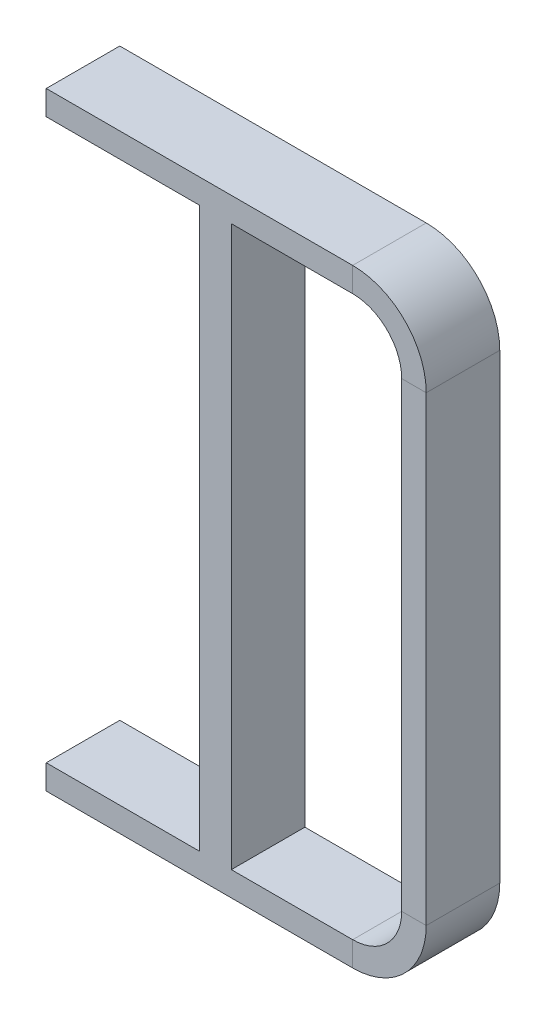
from build123d import *

# Parameters (mm, degrees)
SKETCH2_W           = 152.4
SKETCH2_H           = 50.8
SKETCH3_W           = 66.098972621
SKETCH3_H           = 152.4
BOSS_EXTRUDE1_DEPTH = 1229.106


with BuildPart() as part:
    # Sweep1: sweep along a path in Sketch1
    with BuildLine(Plane.XY) as sweep1_path:
        Line((0, 0), (635, 0))
        ThreePointArc((635, 0), (724.802561211, -37.197438789), (762, -127))
        Line((762, -127), (762, -1083.056))
        ThreePointArc((762, -1083.056), (724.802561211, -1172.858561211), (635, -1210.056))
        Line((635, -1210.056), (0, -1210.056))
    # Sketch2 → Sweep1 (sweep)
    with BuildSketch(Plane(origin=(0, 0, 0), x_dir=(0, 0, -1), z_dir=(1, 0, 0))):
        Rectangle(SKETCH2_W, SKETCH2_H)
    sweep(path=sweep1_path.line)

    # Sketch3 → Boss-Extrude1 (add)
    with BuildSketch(Plane(origin=(0, 25.4, 0), x_dir=(1, 0, 0), z_dir=(0, 1, 0))):
        with Locations((350.549486311, 0)):
            Rectangle(SKETCH3_W, SKETCH3_H)
    extrude(amount=-BOSS_EXTRUDE1_DEPTH)


solid = part.part
